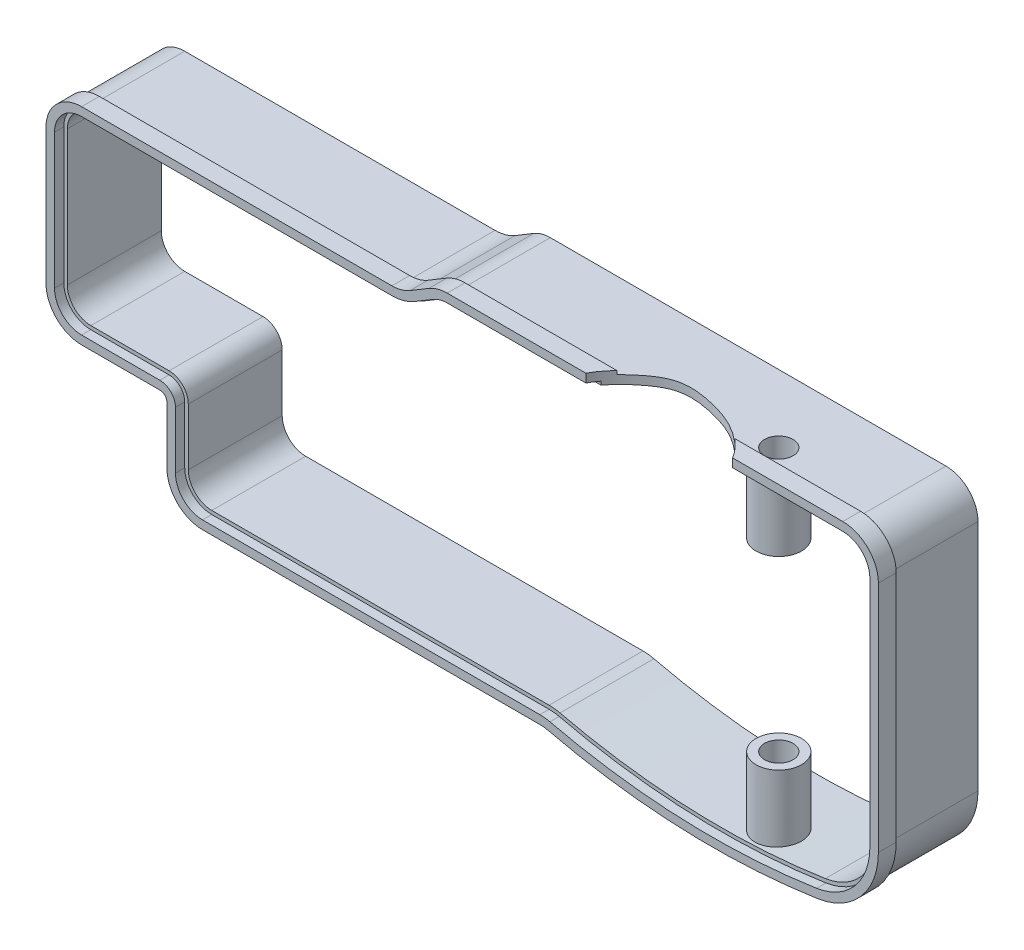
from build123d import *

# Parameters (mm, degrees)
EXTRUDE_1_DEPTH     = 2.5
FILLET_1_R          = 5
FILLET_2_R          = 10
FILLET_3_R          = 5
FILLET_4_R          = 1
EXTRUDE_2_DEPTH     = 12
SKETCH_3_R          = 2
CUT_EXTRUDE_1_DEPTH = 128.145329142
SHELL_1_T           = -1.2
CUT_EXTRUDE_2_DEPTH = 127.419500089
SKETCH_5_W          = 29.908945793
SKETCH_5_H          = 26
CUT_EXTRUDE_3_DEPTH = 12
CUT_EXTRUDE_4_DEPTH = 25


with BuildPart() as part:
    # 草图1 → 凸台-拉伸1 (new body)
    with BuildSketch(Plane.XY):
        with BuildLine():
            Line((17, 0), (17, 14))
            Line((17, 14), (0, 14))
            Line((0, 14), (0, 43))
            Line((0, 43), (50, 43))
            Line((50, 43), (55, 46))
            Line((55, 46), (117, 46))
            Line((117, 46), (117, 43))
            Line((117, 43), (117, 0))
            ThreePointArc((117, 0), (93.5, -2.800462964), (70, 0))
            Line((70, 0), (17, 0))
        make_face()
    extrude(amount=EXTRUDE_1_DEPTH)

    # 圆角1
    fillet_1_edges = [part.edges().sort_by_distance(p)[0] for p in [
        (17, 0, 1.25),
        (0, 14, 1.25),
        (0, 43, 1.25),
        (117, 46, 1.25),
    ]]
    fillet(fillet_1_edges, radius=FILLET_1_R)

    # 圆角2
    fillet_2_edges = [part.edges().sort_by_distance(p)[0] for p in [
        (117, 0, 1.25),
    ]]
    fillet(fillet_2_edges, radius=FILLET_2_R)

    # 圆角3
    fillet_3_edges = [part.edges().sort_by_distance(p)[0] for p in [
        (70, 0, 1.25),
        (50, 43, 1.25),
        (55, 46, 1.25),
    ]]
    fillet(fillet_3_edges, radius=FILLET_3_R)

    # 圆角4
    fillet_4_edges = [part.edges().sort_by_distance(p)[0] for p in [
        (17, 14, 1.25),
    ]]
    fillet(fillet_4_edges, radius=FILLET_4_R)

    # 草图2 → 凸台-拉伸2 (add)
    with BuildSketch(Plane(origin=(0, 0, 0), x_dir=(-1, 0, 0), z_dir=(0, 0, -1))):
        with BuildLine():
            Line((-51.44480683, 43.283788909), (-54.069688925, 44.858718166))
            ThreePointArc((-54.069688925, 44.858718166), (-55.183718706, 45.336717177), (-56.384919825, 45.5))
            Line((-56.384919825, 45.5), (-112, 45.5))
            ThreePointArc((-112, 45.5), (-115.181980515, 44.181980515), (-116.5, 41))
            Line((-116.5, 41), (-116.5, 8.217797336))
            ThreePointArc((-116.5, 8.217797336), (-114.203731672, 2.024555051), (-108.425, -1.174719632))
            ThreePointArc((-108.425, -1.174719632), (-89.475956652, -2.219058182), (-70.673302226, 0.353309083))
            ThreePointArc((-70.673302226, 0.353309083), (-70.04666276, 0.463204186), (-69.411524962, 0.5))
            Line((-69.411524962, 0.5), (-22, 0.5))
            ThreePointArc((-22, 0.5), (-18.818019485, 1.818019485), (-17.5, 5))
            Line((-17.5, 5), (-17.5, 13))
            ThreePointArc((-17.5, 13), (-17.060660172, 14.060660172), (-16, 14.5))
            Line((-16, 14.5), (-5, 14.5))
            ThreePointArc((-5, 14.5), (-1.818019485, 15.818019485), (-0.5, 19))
            Line((-0.5, 19), (-0.5, 38))
            ThreePointArc((-0.5, 38), (-1.818019485, 41.181980515), (-5, 42.5))
            Line((-5, 42.5), (-48.615080175, 42.5))
            ThreePointArc((-48.615080175, 42.5), (-50.083214876, 42.699567895), (-51.44480683, 43.283788909))
        make_face()
    extrude(amount=EXTRUDE_2_DEPTH)

    # 草图3 → 切除-拉伸1 (cut, through all)
    with BuildSketch(Plane(origin=(0, 45.5, 0), x_dir=(1, 0, 0), z_dir=(0, 1, 0))):
        with Locations(Location((98, 2.5, 0), (0, 0, 270))):
            Circle(SKETCH_3_R)
    extrude(amount=-CUT_EXTRUDE_1_DEPTH, mode=Mode.SUBTRACT)

    # 抽壳1
    shell_1_openings = [part.faces().sort_by_distance(p)[0] for p in [
        (62.500022263, 22.701927877, -12),
    ]]
    offset(amount=SHELL_1_T, openings=shell_1_openings, kind=Kind.INTERSECTION)

    # 草图4 → 切除-拉伸2 (cut, through all)
    with BuildSketch(Plane(origin=(0, 0, 1.3), x_dir=(-1, 0, 0), z_dir=(0, 0, -1))):
        with BuildLine():
            Line((-56.384919825, 44.8), (-112, 44.8))
            ThreePointArc((-112, 44.8), (-114.687005769, 43.687005769), (-115.8, 41))
            Line((-115.8, 41), (-115.8, 8.217797336))
            ThreePointArc((-115.8, 8.217797336), (-113.672930391, 2.48089922), (-108.32, -0.482639434))
            ThreePointArc((-108.32, -0.482639434), (-89.504266505, -1.519630879), (-70.83389206, 1.03463933))
            ThreePointArc((-70.83389206, 1.03463933), (-70.12749848, 1.158521082), (-69.411524962, 1.2))
            Line((-69.411524962, 1.2), (-22, 1.2))
            ThreePointArc((-22, 1.2), (-19.312994231, 2.312994231), (-18.2, 5))
            Line((-18.2, 5), (-18.2, 13))
            ThreePointArc((-18.2, 13), (-17.555634919, 14.555634919), (-16, 15.2))
            Line((-16, 15.2), (-5, 15.2))
            ThreePointArc((-5, 15.2), (-2.312994231, 16.312994231), (-1.2, 19))
            Line((-1.2, 19), (-1.2, 38))
            ThreePointArc((-1.2, 38), (-2.312994231, 40.687005769), (-5, 41.8))
            Line((-5, 41.8), (-48.615080175, 41.8))
            ThreePointArc((-48.615080175, 41.8), (-50.270068383, 42.024967445), (-51.804953859, 42.683543861))
            Line((-51.804953859, 42.683543861), (-54.429835954, 44.258473118))
            ThreePointArc((-54.429835954, 44.258473118), (-55.370572214, 44.662116727), (-56.384919825, 44.8))
        make_face()
    extrude(amount=-CUT_EXTRUDE_2_DEPTH, mode=Mode.SUBTRACT)

    # 草图5 → 切除-拉伸3 (cut)
    with BuildSketch(Plane.XY.offset(2.5)):
        with Locations((94.149762403, 21.5)):
            Rectangle(SKETCH_5_W, SKETCH_5_H)
    extrude(amount=-CUT_EXTRUDE_3_DEPTH, mode=Mode.SUBTRACT)

    # 草图6 → 切除-拉伸4 (cut)
    with BuildSketch(Plane(origin=(0, 46, 0), x_dir=(1, 0, 0), z_dir=(0, 1, 0))):
        with BuildLine():
            add(Edge.make_bspline(
                [(96.996390033, -4.054230802), (96.985471859, -2.387863189), (93.231055265, 1.445134708), (88.130068901, 3.304325139), (82.90634874, 4.073922209), (79.327396591, 1.560107395), (76.925149921, -0.689014198), (71.094345742, -10.024640193), (97.032245655, -9.526634001), (96.996390033, -4.054230802)],
                knots=[0, 0, 0, 0, 0.1331942, 0.239246022, 0.354041302, 0.427365379, 0.493243552, 0.562586095, 1, 1, 1, 1], degree=3))
        make_face()
    extrude(amount=-CUT_EXTRUDE_4_DEPTH, mode=Mode.SUBTRACT)


solid = part.part
